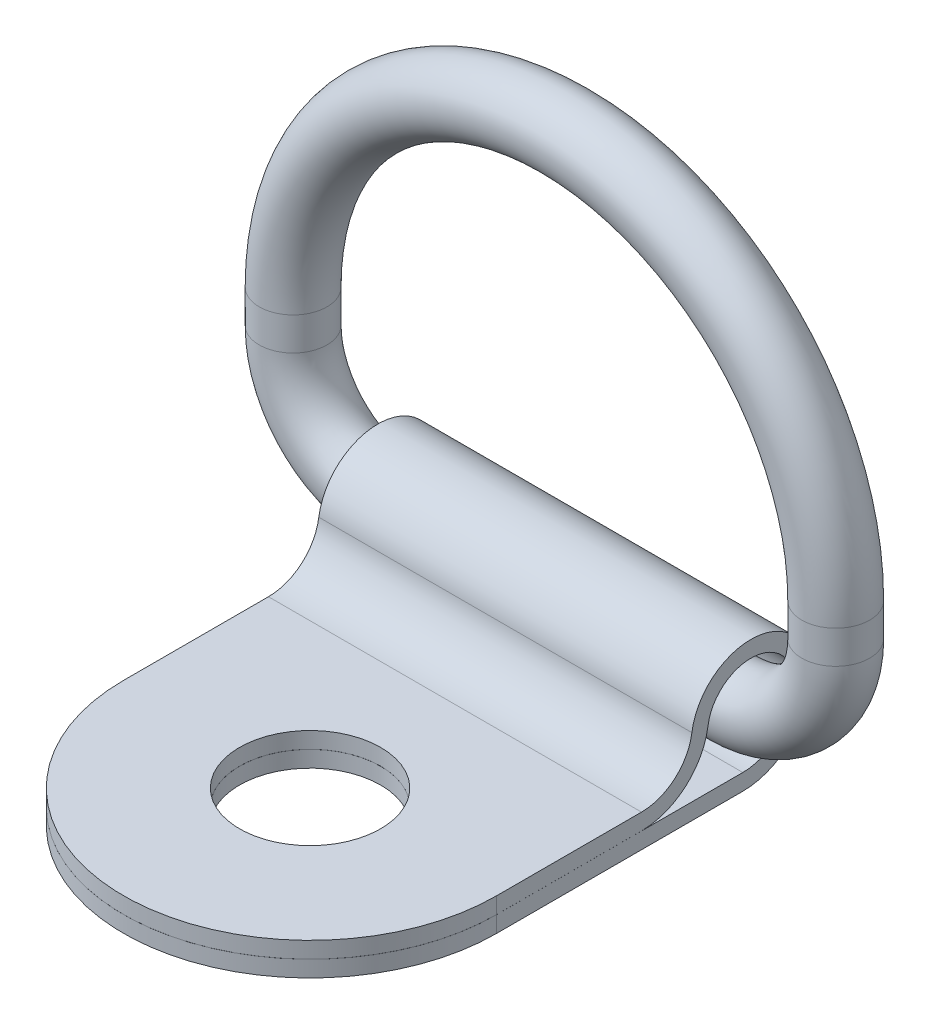
from build123d import *

# Parameters (mm, degrees)
SKETCH2_R           = 1.5875
BOSS_EXTRUDE1_DEPTH = 8.73125
SKETCH4_R           = 3.302
CUT_EXTRUDE1_DEPTH  = 35.598760474
CUT_EXTRUDE2_START  = -2.54
SKETCH5_W           = 19.108331581
SKETCH5_H           = 4.40731651
CUT_EXTRUDE2_DEPTH  = 2.54


with BuildPart() as part:
    # Sweep1: sweep along a path in Sketch1
    with BuildLine(Plane.XY) as sweep1_path:
        Line((-12.7, 6.35), (-12.7, 4.805901242))
        ThreePointArc((-12.7, 4.805901242), (-11.292384116, 1.407615884), (-7.894098758, 0))
        Line((-7.894098758, 0), (7.894098758, 0))
        ThreePointArc((7.894098758, 0), (11.292384116, 1.407615884), (12.7, 4.805901242))
        Line((12.7, 4.805901242), (12.7, 6.35))
        ThreePointArc((12.7, 6.35), (0, 19.05), (-12.7, 6.35))
    # Sketch2 → Sweep1 (sweep)
    with BuildSketch(Plane(origin=(0, 0, 0), x_dir=(0, 0, -1), z_dir=(1, 0, 0))):
        Circle(SKETCH2_R)
    sweep(path=sweep1_path.line)


with BuildPart() as body_2:
    # Sketch3 → Boss-Extrude1 (new, symmetric)
    with BuildSketch(Plane(origin=(0, 0, 0), x_dir=(0, 0, -1), z_dir=(1, 0, 0))):
        with BuildLine():
            Line((-20.6375, -3.175), (-0.381, -3.175))
            ThreePointArc((-0.381, -3.175), (1.86406403, -2.24506403), (2.794, 0))
            ThreePointArc((2.794, 0), (0.198308481, 2.786953488), (-2.765849496, 0.395616687))
            ThreePointArc((-2.765849496, 0.395616687), (-3.563066307, -1.066271632), (-5.12310759, -1.64846))
            Line((-5.12310759, -1.64846), (-20.6375, -1.64846))
            Line((-20.6375, -1.64846), (-20.6375, -2.41046))
            Line((-20.6375, -2.41046), (-5.12310759, -2.41046))
            ThreePointArc((-5.12310759, -2.41046), (-3.063853096, -1.641971355), (-2.011526906, 0.287721227))
            ThreePointArc((-2.011526906, 0.287721227), (0.14422435, 2.026875264), (2.032, 0))
            ThreePointArc((2.032, 0), (1.325248663, -1.706248663), (-0.381, -2.413))
            Line((-0.381, -2.413), (-20.6375, -2.413))
            Line((-20.6375, -2.413), (-20.6375, -3.175))
        make_face()
    extrude(amount=BOSS_EXTRUDE1_DEPTH, both=True)

    # Sketch4 → Cut-Extrude1 (cut, through all)
    with BuildSketch(Plane.XZ.offset(3.175)):
        with Locations(Location((0, 11.90625, 0), (0, 0, 270))):
            Circle(SKETCH4_R)
        with BuildLine():
            Line((-8.73125, 11.90625), (-8.73125, 20.6375))
            Line((-8.73125, 20.6375), (-8.73125, 21.9075))
            Line((-8.73125, 21.9075), (8.73125, 21.9075))
            Line((8.73125, 21.9075), (8.73125, 20.6375))
            Line((8.73125, 20.6375), (8.73125, 11.90625))
            ThreePointArc((8.73125, 11.90625), (0, 20.6375), (-8.73125, 11.90625))
        make_face()
    extrude(amount=-CUT_EXTRUDE1_DEPTH, mode=Mode.SUBTRACT)

    # Sketch5 → Cut-Extrude2 (cut)
    with BuildSketch(Plane.XY.offset(CUT_EXTRUDE2_START)):
        with Locations((-0.530371987, -0.038562852)):
            Rectangle(SKETCH5_W, SKETCH5_H)
    extrude(amount=-CUT_EXTRUDE2_DEPTH, mode=Mode.SUBTRACT)


solid = Compound([part.part, body_2.part])
